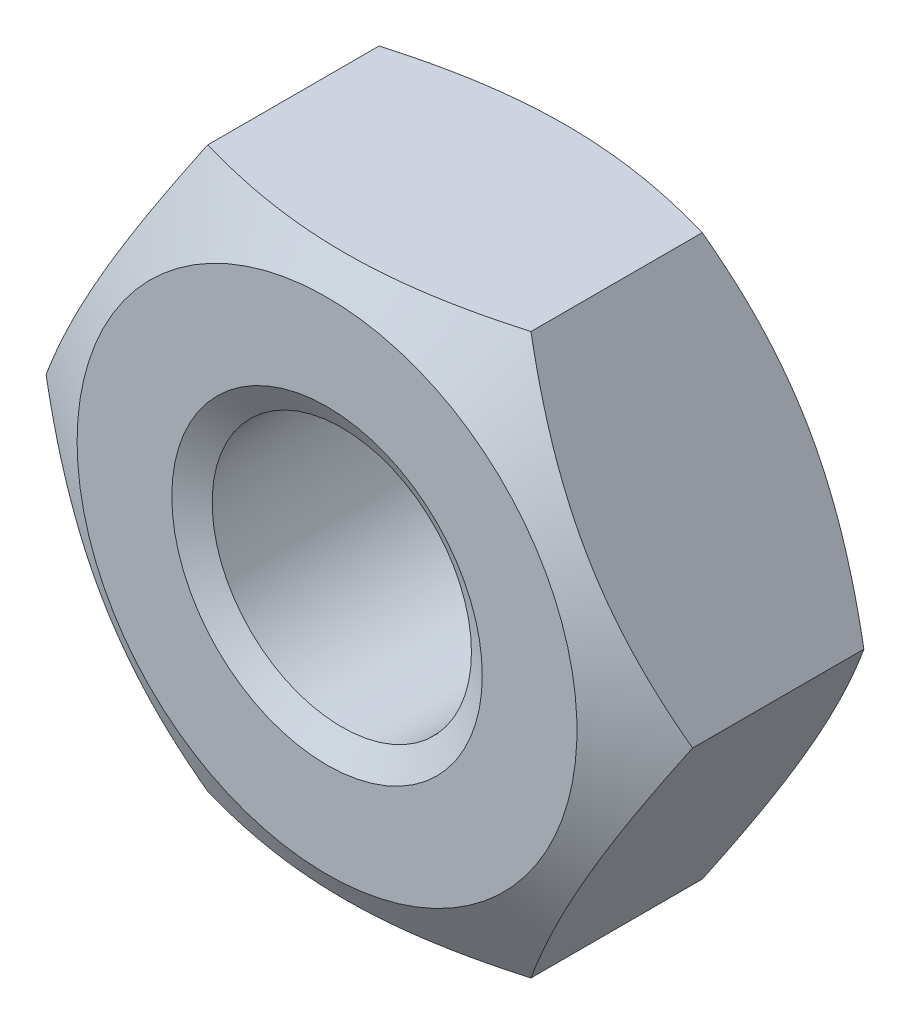
from build123d import *
from OCP.BRepFilletAPI import BRepFilletAPI_MakeChamfer

# Parameters (mm, degrees)
SKETCH1_R        = 1.621
BASENUT_DEPTH    = 3.2
ENDCHAMFER_SIZE  = 0.32
ENDCHAMFER_SIZE2 = 0.184752086


with BuildPart() as part:
    # Sketch1 → BaseNut (new body)
    with BuildSketch(Plane.XY):
        Polygon((2.020725942, -3.5), (4.041451884, 0), (2.020725942, 3.5), (-2.020725942, 3.5), (-4.041451884, 0), (-2.020725942, -3.5), align=None)
        Circle(SKETCH1_R, mode=Mode.SUBTRACT)
    extrude(amount=-BASENUT_DEPTH)

    # Sketch2 → Double-Chamfer (revolve, cut)
    with BuildSketch(Plane(origin=(0, 0, 0), x_dir=(1, 0, 0), z_dir=(0, 1, 0))):
        Polygon((-4.041451884, 3.2), (-3.125, 3.2), (-4.041451884, 2.670886258), align=None)
        Polygon((-4.041451884, 0.529113742), (-4.041451884, 0), (-3.125, 0), align=None)
    revolve(axis=Axis((0, 0, -3.375940562), (0, 0, 1)), mode=Mode.SUBTRACT)

    # EndChamfer: one chamfer whose edges measure the first distance from different faces: ONE call of the kernel's chamfer builder (chamfer() names one face for all edges)
    endchamfer_edges_1 = [part.edges().sort_by_distance(p)[0] for p in [
        (-1.621, 0, -3.2),
    ]]
    endchamfer_side_1 = [part.faces().sort_by_distance(p)[0] for p in [
        (-1.621, 0, -1.6),
    ]]
    endchamfer_edges_2 = [part.edges().sort_by_distance(p)[0] for p in [
        (-1.621, 0, 0),
    ]]
    endchamfer_side_2 = [part.faces().sort_by_distance(p)[0] for p in [
        (3.036611652, 0, 0),
    ]]
    endchamfer = BRepFilletAPI_MakeChamfer(part.part.solid().wrapped)
    for e in endchamfer_edges_1:
        endchamfer.Add(ENDCHAMFER_SIZE, ENDCHAMFER_SIZE2, e.wrapped, endchamfer_side_1[0].wrapped)  # the first distance lies on this face
    for e in endchamfer_edges_2:
        endchamfer.Add(ENDCHAMFER_SIZE, ENDCHAMFER_SIZE2, e.wrapped, endchamfer_side_2[0].wrapped)  # the first distance lies on this face
    add(Compound.cast(endchamfer.Shape()), mode=Mode.REPLACE)


solid = part.part
